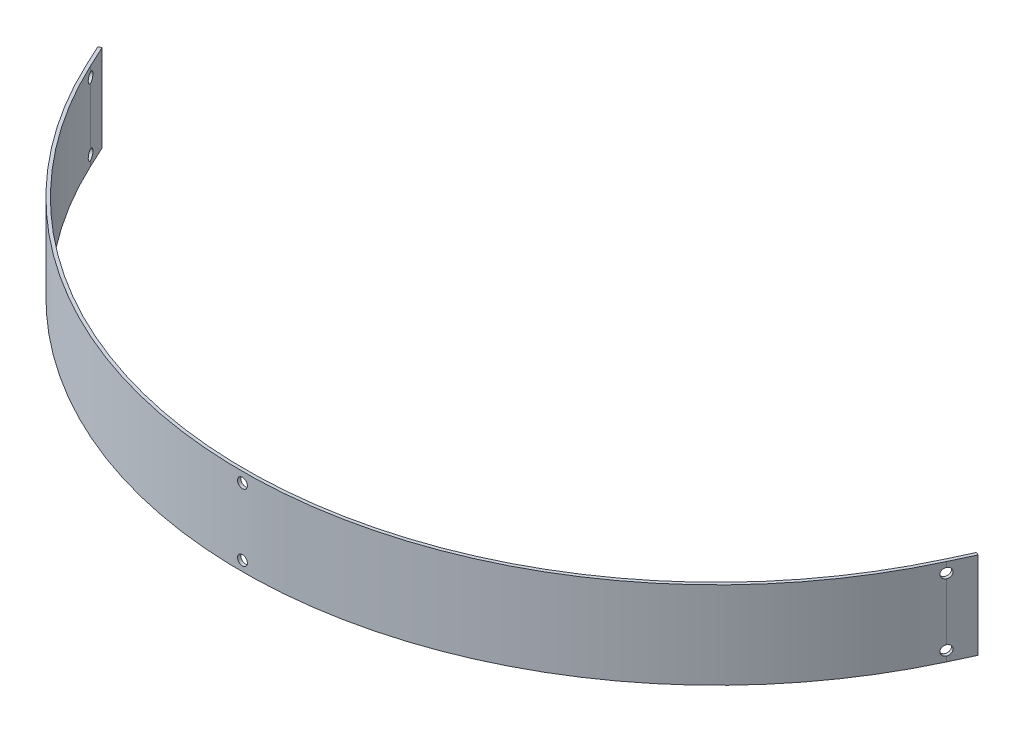
from build123d import *

# Parameters (mm, degrees)
SKETCH2_W                       = 1
SKETCH2_H                       = 27.5
REVOLVE1_ANGLE                  = 130
SKETCH3_W                       = 1
SKETCH3_H                       = 27.5
BOSS_EXTRUDE1_DEPTH             = 7.5
SKETCH4_W                       = 1
SKETCH4_H                       = 27.5
BOSS_EXTRUDE2_DEPTH             = 7.5
M2_5_CLEARANCE_HOLE1_D          = 3.1
CIRPATTERN1_COUNT               = 2
CIRPATTERN1_ANGLE               = 65
CIRPATTERN1_THE_OTHER_WAY_COUNT = 2
CIRPATTERN1_THE_OTHER_WAY_ANGLE = 65


with BuildPart() as part:
    # Sketch2 → Revolve1 (revolve, symmetric)
    with BuildSketch(Plane(origin=(0, 0, 0), x_dir=(0, 0, -1), z_dir=(1, 0, 0))) as revolve1_sk:
        with Locations((-149.5, 0)):
            Rectangle(SKETCH2_W, SKETCH2_H)
    revolve(axis=Axis((0, -1000, 0), (0, 1, 0)), revolution_arc=REVOLVE1_ANGLE / 2)
    revolve(revolve1_sk.sketch, axis=Axis((0, -1000, 0), (0, -1, 0)), revolution_arc=REVOLVE1_ANGLE / 2)

    # Sketch3 → Boss-Extrude1 (add)
    with BuildSketch(Plane(origin=(0, 0, 0), x_dir=(-0.9063077870366509, 1.4496858692468702e-15, -0.4226182617406975), z_dir=(0.4226182617406975, 3.1088613791648487e-15, -0.9063077870366509))):
        with Locations((-149.5, 0)):
            Rectangle(SKETCH3_W, SKETCH3_H)
    extrude(amount=BOSS_EXTRUDE1_DEPTH)

    # Sketch4 → Boss-Extrude2 (add)
    with BuildSketch(Plane(origin=(0, 0, 0), x_dir=(-0.906307787036651, -1.4496858692468694e-15, 0.4226182617406973), z_dir=(-0.4226182617406973, 3.1088613791648455e-15, -0.906307787036651))):
        with Locations((149.5, 0)):
            Rectangle(SKETCH4_W, SKETCH4_H)
    extrude(amount=BOSS_EXTRUDE2_DEPTH)

    # M2.5 Clearance Hole1 (through all)
    with Locations(Plane(origin=(0, 0, 0), x_dir=(1, 0, 0), z_dir=(0, 0, -1))):
        with Locations((0, -10.575), (0, 10.575)):
            m2_5_clearance_hole1 = Hole(M2_5_CLEARANCE_HOLE1_D / 2)

    # CirPattern1: M2.5 Clearance Hole1 ×2 about axis
    cirpattern1_axis = Axis((0, -1000, 0), (0, 1, 0))
    for i in range(1, CIRPATTERN1_COUNT):
        add(m2_5_clearance_hole1.rotate(cirpattern1_axis, i * CIRPATTERN1_ANGLE / (CIRPATTERN1_COUNT - 1)), mode=Mode.SUBTRACT)

    # CirPattern1 the other way: M2.5 Clearance Hole1 ×2 about axis
    cirpattern1_the_other_way_axis = Axis((0, -1000, 0), (0, -1, 0))
    for i in range(1, CIRPATTERN1_THE_OTHER_WAY_COUNT):
        add(m2_5_clearance_hole1.rotate(cirpattern1_the_other_way_axis, i * CIRPATTERN1_THE_OTHER_WAY_ANGLE / (CIRPATTERN1_THE_OTHER_WAY_COUNT - 1)), mode=Mode.SUBTRACT)


solid = part.part
